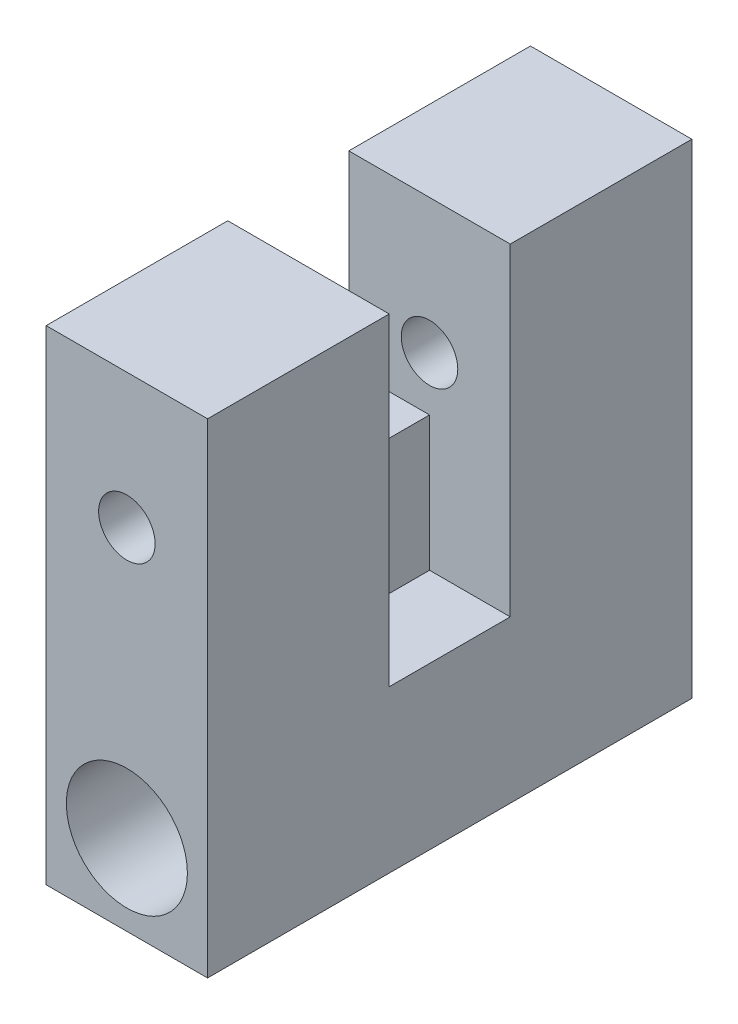
from build123d import *

# Parameters (mm, degrees)
SKETCH2_W           = 6
SKETCH2_H           = 18
BOSS_EXTRUDE1_DEPTH = 18
SKETCH3_R           = 2.25
CUT_EXTRUDE1_DEPTH  = 21.346989949
SKETCH4_W           = 4.5
SKETCH4_H           = 12
CUT_EXTRUDE2_DEPTH  = 3
SKETCH5_R           = 1.05
CUT_EXTRUDE3_DEPTH  = 21.346989949
SKETCH8_W           = 4.5
SKETCH8_H           = 7
CUT_EXTRUDE6_DEPTH  = 10


with BuildPart() as part:
    # Sketch2 → Boss-Extrude1 (new body)
    with BuildSketch(Plane.XY):
        Rectangle(SKETCH2_W, SKETCH2_H)
    extrude(amount=BOSS_EXTRUDE1_DEPTH)

    # Sketch3 → Cut-Extrude1 (cut, through all)
    with BuildSketch(Plane.XY.offset(18)):
        with Locations((0, -6)):
            Circle(SKETCH3_R)
    extrude(amount=-CUT_EXTRUDE1_DEPTH, mode=Mode.SUBTRACT)

    # Sketch4 → Cut-Extrude2 (cut)
    with BuildSketch(Plane(origin=(3, 0, 0), x_dir=(0, 0, -1), z_dir=(1, 0, 0))):
        with Locations((-9, 3)):
            Rectangle(SKETCH4_W, SKETCH4_H)
    extrude(amount=-CUT_EXTRUDE2_DEPTH, mode=Mode.SUBTRACT)

    # Sketch5 → Cut-Extrude3 (cut, through all)
    with BuildSketch(Plane.XY.offset(18)):
        with Locations((0, 4)):
            Circle(SKETCH5_R)
    extrude(amount=-CUT_EXTRUDE3_DEPTH, mode=Mode.SUBTRACT)

    # Sketch8 → Cut-Extrude6 (cut)
    with BuildSketch(Plane(origin=(3, 0, 0), x_dir=(0, 0, -1), z_dir=(1, 0, 0))):
        with Locations((-9, 5.5)):
            Rectangle(SKETCH8_W, SKETCH8_H)
    extrude(amount=-CUT_EXTRUDE6_DEPTH, mode=Mode.SUBTRACT)


solid = part.part
